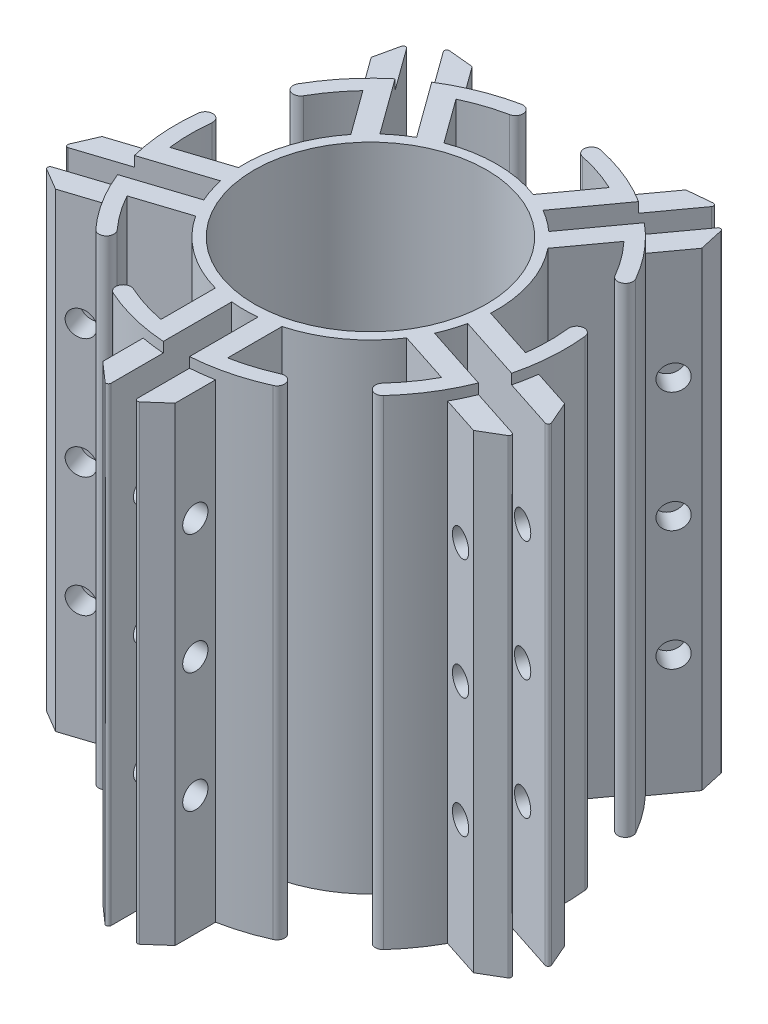
from build123d import *
from build123d.topology import SkipClean

# Parameters (mm, degrees)
SKETCH2_R                = 31.75
SKETCH2_R_2              = 29.21
EXTRUDE_THIN1_DEPTH      = 120.65
BOSS_EXTRUDE1_DEPTH      = 120.65
CUT_EXTRUDE3_START       = -2.54
CUT_EXTRUDE3_DEPTH       = 2.54
FILLET1_R                = 0.635
SKETCH3_R                = 3.175
CUT_EXTRUDE1_DEPTH       = 142.900034849
CIRPATTERN1_COUNT        = 5
FILLET1_OF_CIRPATTERN1_R = 0.635


with BuildPart() as part:
    # Sketch2 → Extrude-Thin1 (new body)
    with BuildSketch(Plane(origin=(0, 0, 0), x_dir=(1, 0, 0), z_dir=(0, 1, 0))):
        Circle(SKETCH2_R)
        Circle(SKETCH2_R_2, mode=Mode.SUBTRACT)
    extrude(amount=EXTRUDE_THIN1_DEPTH)

    # Sketch1 → Boss-Extrude1 (add)
    with BuildSketch(Plane(origin=(0, 0, 0), x_dir=(1, 0, 0), z_dir=(0, 1, 0))):
        with BuildLine():
            ThreePointArc((-3.302, -29.022765134), (-5.865151764, -28.615102565), (-8.382, -27.981532767))
            Line((-8.382, -27.981532767), (-8.382, -44.298976297))
            ThreePointArc((-8.382, -44.298976297), (-13.55694612, -42.998446913), (-18.542, -41.09563798))
            ThreePointArc((-18.542, -41.09563798), (-21.061900196, -42.048608599), (-20.108929577, -44.568508795))
            ThreePointArc((-20.108929577, -44.568508795), (-14.702603538, -46.632118483), (-9.090338028, -48.042551759))
            Line((-9.090338028, -48.042551759), (-9.090338028, -58.202551759))
            Line((-9.090338028, -58.202551759), (-3.302, -63.312765134))
            Line((-3.302, -63.312765134), (-3.302, -29.022765134))
        make_face()
        with BuildLine():
            Line((8.382, -44.298976297), (8.382, -27.981532767))
            ThreePointArc((8.382, -27.981532767), (5.865151764, -28.615102565), (3.302, -29.022765134))
            Line((3.302, -29.022765134), (3.302, -63.312765134))
            Line((3.302, -63.312765134), (9.090338028, -58.202551759))
            Line((9.090338028, -58.202551759), (9.090338028, -48.042551759))
            ThreePointArc((9.090338028, -48.042551759), (14.702603538, -46.632118483), (20.108929577, -44.568508795))
            ThreePointArc((20.108929577, -44.568508795), (21.061900196, -42.048608599), (18.542, -41.09563798))
            ThreePointArc((18.542, -41.09563798), (13.55694612, -42.998446913), (8.382, -44.298976297))
        make_face()
    boss_extrude1 = extrude(amount=BOSS_EXTRUDE1_DEPTH)

    # Sketch6 → Cut-Extrude3 (cut)
    with BuildSketch(Plane(origin=(0, 120.65, 0), x_dir=(1, 0, 0), z_dir=(0, 1, 0)).offset(CUT_EXTRUDE3_START)):
        with BuildLine():
            Line((-9.090338028, -48.042551759), (-12.395915493, -65.512570581))
            ThreePointArc((-12.395915493, -65.512570581), (0, -66.675), (12.395915493, -65.512570581))
            Line((12.395915493, -65.512570581), (9.090338028, -48.042551759))
            ThreePointArc((9.090338028, -48.042551759), (0, -48.895), (-9.090338028, -48.042551759))
        make_face()
    cut_extrude3 = extrude(amount=CUT_EXTRUDE3_DEPTH, mode=Mode.SUBTRACT)

    # Fillet1
    fillet1_edges = [part.edges().sort_by_distance(p)[0] for p in [
        (3.302, 59.055, 63.312765134),
        (-3.302, 59.055, 63.312765134),
    ]]
    fillet(fillet1_edges, radius=FILLET1_R)

    # Sketch3 → Cut-Extrude1 (cut, through all)
    with BuildSketch(Plane(origin=(9.090338028, 0, 0), x_dir=(0, 0, -1), z_dir=(1, 0, 0))):
        with Locations((-53.122551759, 90.4875)):
            Circle(SKETCH3_R)
        with Locations((-53.122551759, 60.325)):
            Circle(SKETCH3_R)
        with Locations((-53.122551759, 30.1625)):
            Circle(SKETCH3_R)
    cut_extrude1 = extrude(amount=-CUT_EXTRUDE1_DEPTH, mode=Mode.SUBTRACT)

    # CirPattern1: Boss-Extrude1, Cut-Extrude3, Cut-Extrude1 ×5 about axis
    with SkipClean():  # the faces are left unmerged after this step: merging them gives an invalid solid
        cirpattern1_axis = Axis((0, 0, 0), (0, 1, 0))
        add([boss_extrude1.rotate(cirpattern1_axis, i * 360 / CIRPATTERN1_COUNT) for i in range(1, CIRPATTERN1_COUNT)])
        add([cut_extrude3.rotate(cirpattern1_axis, i * 360 / CIRPATTERN1_COUNT) for i in range(1, CIRPATTERN1_COUNT)], mode=Mode.SUBTRACT)
        add([cut_extrude1.rotate(cirpattern1_axis, i * 360 / CIRPATTERN1_COUNT) for i in range(1, CIRPATTERN1_COUNT)], mode=Mode.SUBTRACT)

    # Fillet1 of CirPattern1
    fillet1_of_cirpattern1_edges = [part.edges().sort_by_distance(p)[0] for p in [
        (61.23439196, 59.055, 16.42433177),
        (59.19364373, 59.055, 22.705109004),
        (34.542935512, 59.055, -53.161969857),
        (39.885683743, 59.055, -49.280236051),
        (-39.885683743, 59.055, -49.280236051),
        (-34.542935512, 59.055, -53.161969857),
        (-59.19364373, 59.055, 22.705109004),
        (-61.23439196, 59.055, 16.42433177),
    ]]
    fillet(fillet1_of_cirpattern1_edges, radius=FILLET1_OF_CIRPATTERN1_R)


solid = part.part
